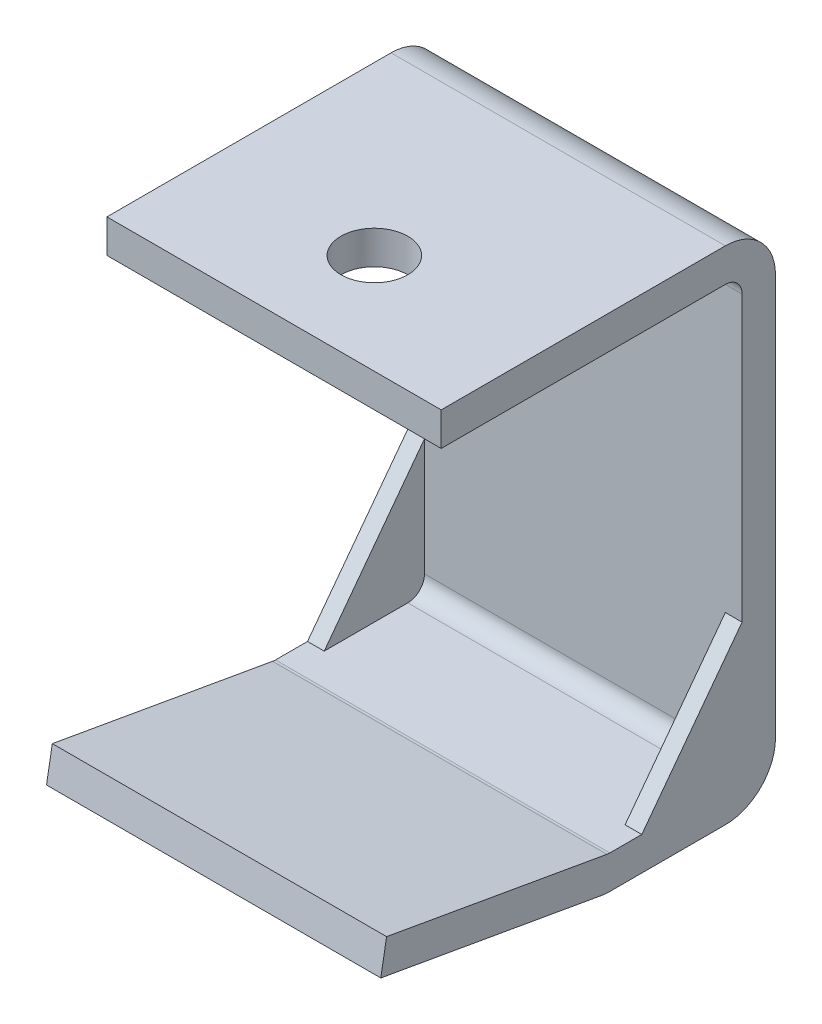
from build123d import *

# Parameters (mm, degrees)
BASE_EXTRUDE_THIN_DEPTH = 31.75
CUT_EXTRUDE1_REACH      = 123.615
SKETCH2_R               = 6.35
BOSS_EXTRUDE1_DEPTH     = 3.175


with BuildPart() as part:
    # Sketch1 → Base-Extrude-Thin (new, symmetric)
    with BuildSketch(Plane(origin=(0, 0, 0), x_dir=(0, 0, -1), z_dir=(1, 0, 0))):
        with BuildLine():
            Line((-67.523772904, 7.427557692), (-25.673556457, 0.048235384))
            ThreePointArc((-25.673556457, 0.048235384), (-25.398942977, 0.012081834), (-25.122223493, 0))
            Line((-25.122223493, 0), (-3.175, 0))
            ThreePointArc((-3.175, 0), (-0.92993597, 0.92993597), (0, 3.175))
            Line((0, 3.175), (0, 79.375))
            ThreePointArc((0, 79.375), (-0.92993597, 81.62006403), (-3.175, 82.55))
            Line((-3.175, 82.55), (-57.15, 82.55))
            Line((-57.15, 82.55), (-57.15, 88.9))
            Line((-57.15, 88.9), (-3.175, 88.9))
            ThreePointArc((-3.175, 88.9), (3.560192091, 86.110192091), (6.35, 79.375))
            Line((6.35, 79.375), (6.35, 3.175))
            ThreePointArc((6.35, 3.175), (3.560192091, -3.560192091), (-3.175, -6.35))
            Line((-3.175, -6.35), (-25.122223493, -6.35))
            ThreePointArc((-25.122223493, -6.35), (-25.952381943, -6.313754499), (-26.776222386, -6.205293847))
            Line((-26.776222386, -6.205293847), (-68.626438832, 1.174028461))
            Line((-68.626438832, 1.174028461), (-67.523772904, 7.427557692))
        make_face()
    extrude(amount=BASE_EXTRUDE_THIN_DEPTH, both=True)

    # Sketch2 → Cut-Extrude1 (cut, up to next)
    with BuildSketch(Plane(origin=(0, 88.9, 0), x_dir=(-1, 0, 0), z_dir=(0, 1, 0)), mode=Mode.PRIVATE) as cut_extrude1_sk1:
        with Locations(Location((0, 38.1, 0), (0, 0, 90))):
            Circle(SKETCH2_R)
    cut_extrude1_tool1 = extrude(cut_extrude1_sk1.sketch, amount=-CUT_EXTRUDE1_REACH, mode=Mode.PRIVATE) & part.part
    add(cut_extrude1_tool1.solids().sort_by_distance((0, 88.9, 38.1))[0], mode=Mode.SUBTRACT)

    # Sketch3 → Boss-Extrude1 (add)
    with BuildSketch(Plane(origin=(31.75, 0, 0), x_dir=(0, 0, -1), z_dir=(1, 0, 0))):
        with BuildLine():
            Line((-19.05, 0), (-3.175, 0))
            ThreePointArc((-3.175, 0), (-0.92993597, 0.92993597), (0, 3.175))
            Line((0, 3.175), (0, 25.4))
            Line((0, 25.4), (-19.05, 0))
        make_face()
    boss_extrude1 = extrude(amount=-BOSS_EXTRUDE1_DEPTH)

    # Mirror1: Boss-Extrude1 across plane
    add(boss_extrude1.mirror(Plane(origin=(0, 0, 0), x_dir=(0, 0, 1), z_dir=(1, 0, 0))))


solid = part.part
